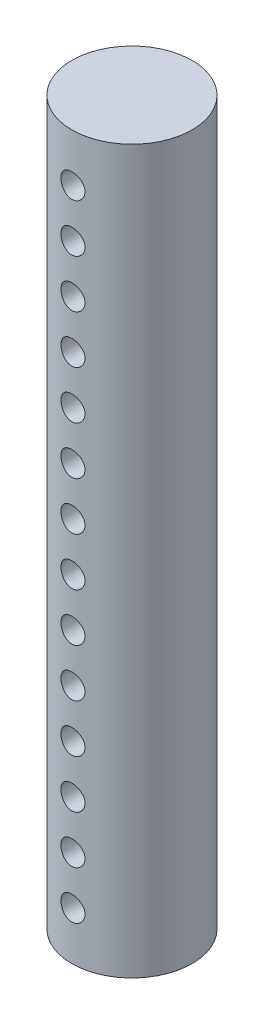
from build123d import *

# Parameters (mm, degrees)
SKETCH1_R               = 25
BOSS_EXTRUDE1_DEPTH     = 300
CUT_EXTRUDE1_DEPTH      = 303.07614934
CUT_EXTRUDE1_DEPTH_BACK = 303.07614934
SKETCH2_R               = 5


with BuildPart() as part:
    # Sketch1 → Boss-Extrude1 (new body)
    with BuildSketch(Plane(origin=(0, 0, 0), x_dir=(1, 0, 0), z_dir=(0, 1, 0))):
        with Locations(Location((0, 0, 0), (0, 0, 270))):
            Circle(SKETCH1_R)
    extrude(amount=BOSS_EXTRUDE1_DEPTH)

    # Sketch2 → Cut-Extrude1 (cut, two sides: drawn at the far end of the back side and taken through both)
    with BuildSketch(Plane.XY.offset(-CUT_EXTRUDE1_DEPTH_BACK)):
        with Locations((0, 280)):
            Circle(SKETCH2_R)
        with Locations((0, 260)):
            Circle(SKETCH2_R)
        with Locations((0, 240)):
            Circle(SKETCH2_R)
        with Locations((0, 220)):
            Circle(SKETCH2_R)
        with Locations((0, 200)):
            Circle(SKETCH2_R)
        with Locations((0, 180)):
            Circle(SKETCH2_R)
        with Locations((0, 160)):
            Circle(SKETCH2_R)
        with Locations((0, 140)):
            Circle(SKETCH2_R)
        with Locations((0, 120)):
            Circle(SKETCH2_R)
        with Locations((0, 100)):
            Circle(SKETCH2_R)
        with Locations((0, 80)):
            Circle(SKETCH2_R)
        with Locations((0, 60)):
            Circle(SKETCH2_R)
        with Locations((0, 40)):
            Circle(SKETCH2_R)
        with Locations((0, 20)):
            Circle(SKETCH2_R)
    extrude(amount=CUT_EXTRUDE1_DEPTH + CUT_EXTRUDE1_DEPTH_BACK, mode=Mode.SUBTRACT)


solid = part.part
